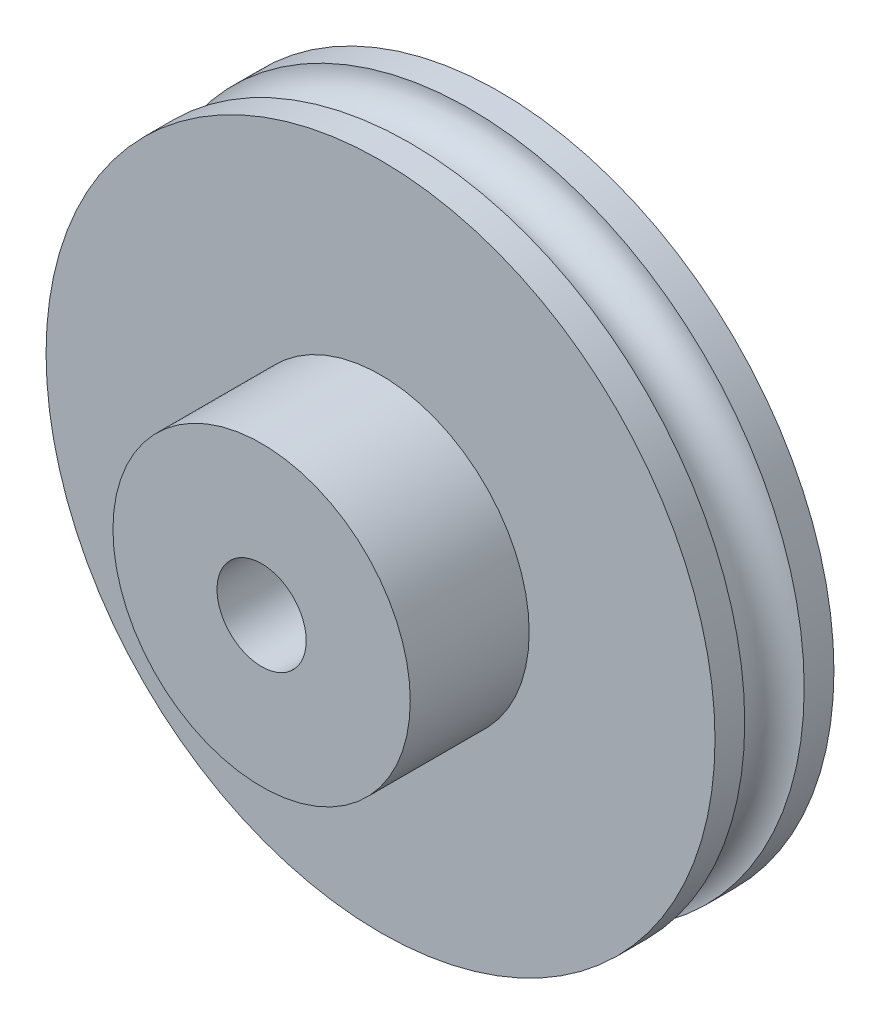
from build123d import *

# Parameters (mm, degrees)
SKETCH_1_R          = 22.5
EXTRUDE_1_DEPTH     = 8
SKETCH_2_R          = 2
SKETCH_3_R          = 10
EXTRUDE_2_DEPTH     = 8
SKETCH_4_R          = 3
CUT_EXTRUDE_1_DEPTH = 36.616007637


with BuildPart() as part:
    # 草图1 → 凸台-拉伸1 (new body)
    with BuildSketch(Plane.XY):
        Circle(SKETCH_1_R)
    extrude(amount=EXTRUDE_1_DEPTH)

    # 草图2 → 切除-旋转1 (revolve, cut)
    with BuildSketch(Plane(origin=(0, 0, 0), x_dir=(1, 0, 0), z_dir=(0, 1, 0)), mode=Mode.PRIVATE) as cut_revolve_1_sk:
        with Locations((-22.5, -4)):
            Circle(SKETCH_2_R)
    revolve(cut_revolve_1_sk.sketch.rotate(Axis((0, 0, 8), (0, 0, -1)), 180), axis=Axis((0, 0, 8), (0, 0, -1)), mode=Mode.SUBTRACT)

    # 草图3 → 凸台-拉伸2 (add)
    with BuildSketch(Plane.XY.offset(8)):
        Circle(SKETCH_3_R)
    extrude(amount=EXTRUDE_2_DEPTH)

    # 草图4 → 切除-拉伸1 (cut, through all)
    with BuildSketch(Plane.XY.offset(16)):
        Circle(SKETCH_4_R)
    extrude(amount=-CUT_EXTRUDE_1_DEPTH, mode=Mode.SUBTRACT)


solid = part.part
